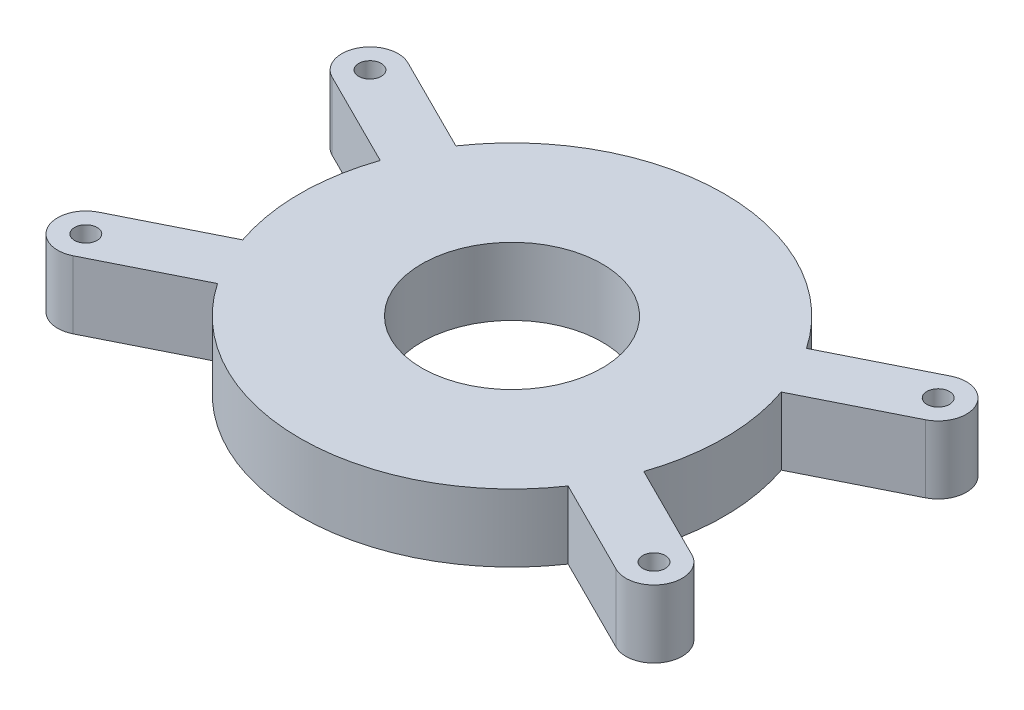
from build123d import *

# Parameters (mm, degrees)
SKETCH_1_R               = 20
EXTRUDE_1_DEPTH          = 15
SKETCH_2_R               = 2.5
CUT_EXTRUDE_1_DEPTH      = 5
MIRROR_2_COPY_1_SKETCH_R = 2.5
MIRROR_2_COPY_1_DEPTH    = 5
MIRROR_3_COPY_1_SKETCH_R = 2.5
MIRROR_3_COPY_1_DEPTH    = 5
MIRROR_3_COPY_2_SKETCH_R = 2.5
MIRROR_3_COPY_2_DEPTH    = 5
MIRROR_3_COPY_3_SKETCH_R = 2.5
MIRROR_3_COPY_3_DEPTH    = 5


with BuildPart() as part:
    # 草图1 → 凸台-拉伸1 (new body)
    with BuildSketch(Plane(origin=(0, 0, 0), x_dir=(1, 0, 0), z_dir=(0, 1, 0))):
        with BuildLine():
            Line((44.458501576, 15.246036783), (65.781966365, 25.910071498))
            ThreePointArc((65.781966365, 25.910071498), (68.576327064, 34.295567803), (60.190830759, 37.089928502))
            Line((60.190830759, 37.089928502), (38.867365971, 26.425893787))
            ThreePointArc((38.867365971, 26.425893787), (0, 47), (-38.867365971, 26.425893787))
            Line((-38.867365971, 26.425893787), (-60.190830759, 37.089928502))
            ThreePointArc((-60.190830759, 37.089928502), (-68.576327064, 34.295567803), (-65.781966365, 25.910071498))
            Line((-65.781966365, 25.910071498), (-44.458501576, 15.246036783))
            ThreePointArc((-44.458501576, 15.246036783), (-47, 0), (-44.458501576, -15.246036783))
            Line((-44.458501576, -15.246036783), (-65.781966365, -25.910071498))
            ThreePointArc((-65.781966365, -25.910071498), (-68.576327064, -34.295567803), (-60.190830759, -37.089928502))
            Line((-60.190830759, -37.089928502), (-38.867365971, -26.425893787))
            ThreePointArc((-38.867365971, -26.425893787), (0, -47), (38.867365971, -26.425893787))
            Line((38.867365971, -26.425893787), (60.190830759, -37.089928502))
            ThreePointArc((60.190830759, -37.089928502), (68.576327064, -34.295567803), (65.781966365, -25.910071498))
            Line((65.781966365, -25.910071498), (44.458501576, -15.246036783))
            ThreePointArc((44.458501576, -15.246036783), (47, 0), (44.458501576, 15.246036783))
        make_face()
        with Locations(Location((0, 0, 0), (0, 0, 270))):
            Circle(SKETCH_1_R, mode=Mode.SUBTRACT)
    extrude(amount=EXTRUDE_1_DEPTH)

    # 草图2 → 切除-拉伸1 (cut)
    with BuildSketch(Plane(origin=(0, 15, 0), x_dir=(1, 0, 0), z_dir=(0, 1, 0))):
        with Locations(Location((-62.986398562, 31.5, 0), (0, 0, 270))):
            Circle(SKETCH_2_R)
    cut_extrude_1 = extrude(amount=-CUT_EXTRUDE_1_DEPTH, mode=Mode.SUBTRACT)

    # 镜向1: 切除-拉伸1 across plane
    add(cut_extrude_1.mirror(Plane.XY), mode=Mode.SUBTRACT)

    # 镜向2: 切除-拉伸1 across plane
    add(cut_extrude_1.mirror(Plane(origin=(0, 0, 0), x_dir=(0, 0, 1), z_dir=(1, 0, 0))), mode=Mode.SUBTRACT)

    # 镜向2 copy 1 sketch → 镜向2 copy 1 (cut)
    with BuildSketch(Plane(origin=(0, 15, 0), x_dir=(-1, 0, 0), z_dir=(0, 1, 0))):
        with Locations(Location((-62.986398562, 31.5, 0), (0, 0, 270))):
            Circle(MIRROR_2_COPY_1_SKETCH_R)
    extrude(amount=-MIRROR_2_COPY_1_DEPTH, mode=Mode.SUBTRACT)

    # 镜向3: 切除-拉伸1 across plane
    add(cut_extrude_1.mirror(Plane(origin=(0, 7.5, 0), x_dir=(0, 0, 1), z_dir=(0, -1, 0))), mode=Mode.SUBTRACT)

    # 镜向3 copy 1 sketch → 镜向3 copy 1 (cut)
    with BuildSketch(Plane.XZ):
        with Locations(Location((-62.986398562, 31.5, 0), (0, 0, 270))):
            Circle(MIRROR_3_COPY_1_SKETCH_R)
    extrude(amount=-MIRROR_3_COPY_1_DEPTH, mode=Mode.SUBTRACT)

    # 镜向3 copy 2 sketch → 镜向3 copy 2 (cut)
    with BuildSketch(Plane(origin=(0, 0, 0), x_dir=(-1, 0, 0), z_dir=(0, -1, 0))):
        with Locations(Location((-62.986398562, 31.5, 0), (0, 0, 270))):
            Circle(MIRROR_3_COPY_2_SKETCH_R)
    extrude(amount=-MIRROR_3_COPY_2_DEPTH, mode=Mode.SUBTRACT)

    # 镜向3 copy 3 sketch → 镜向3 copy 3 (cut)
    with BuildSketch(Plane(origin=(0, 0, 0), x_dir=(-1, 0, 0), z_dir=(0, -1, 0))):
        with Locations((-62.986398562, -31.5)):
            Circle(MIRROR_3_COPY_3_SKETCH_R)
    extrude(amount=-MIRROR_3_COPY_3_DEPTH, mode=Mode.SUBTRACT)


solid = part.part
